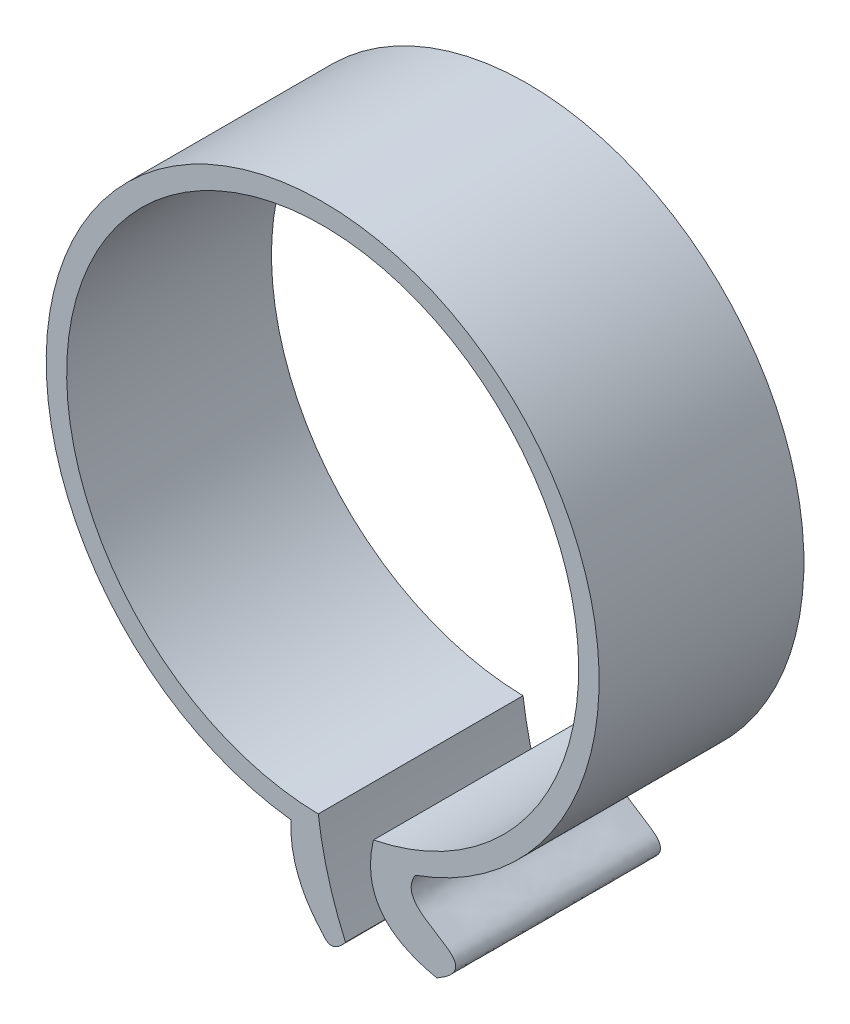
from build123d import *

# Parameters (mm, degrees)
BOSS_EXTRUDE1_DEPTH = 10


with BuildPart() as part:
    # Sketch1 → Boss-Extrude1 (new body)
    with BuildSketch(Plane.XY):
        with BuildLine():
            ThreePointArc((2.47842575, -12.251832753), (-1.137379909, 12.448147129), (-0.217037467, -12.498115647))
            add(Edge.make_bspline(
                [(-0.217037467, -12.498115647), (0.103518304, -14.995056083), (1.115421548, -17.260389343)],
                knots=[0, 0, 0, 1, 1, 1], degree=2))
            add(Edge.make_bspline(
                [(1.115421548, -17.260389343), (0.434564651, -18.108574327), (0, -17.447731212)],
                knots=[0, 0, 0, 1, 1, 1], degree=2))
            add(Edge.make_bspline(
                [(0, -17.447731212), (-1.091166652, -16.283532634), (-1.609840573, -14.937630884), (-1.556021763, -13.410025961)],
                knots=[0, 0, 0, 0, 0.825397526, 0.825397526, 0.825397526, 0.825397526], degree=3))
            ThreePointArc((-1.556021763, -13.410025961), (-1.523641622, 13.413743557), (4.524014275, -12.71940623))
            add(Edge.make_bspline(
                [(4.524014275, -12.71940623), (3.253229228, -14.746642768), (8.549206323, -14.842102086), (5.577194292, -16.538556843)],
                knots=[0, 0, 0, 0, 1, 1, 1, 1], degree=3))
            add(Edge.make_bspline(
                [(2.47842575, -12.251832753), (1.654957901, -15.727340902), (5.577194292, -16.538556843)],
                knots=[0, 0, 0, 1, 1, 1], degree=2))
        make_face()
    extrude(amount=BOSS_EXTRUDE1_DEPTH)


solid = part.part
